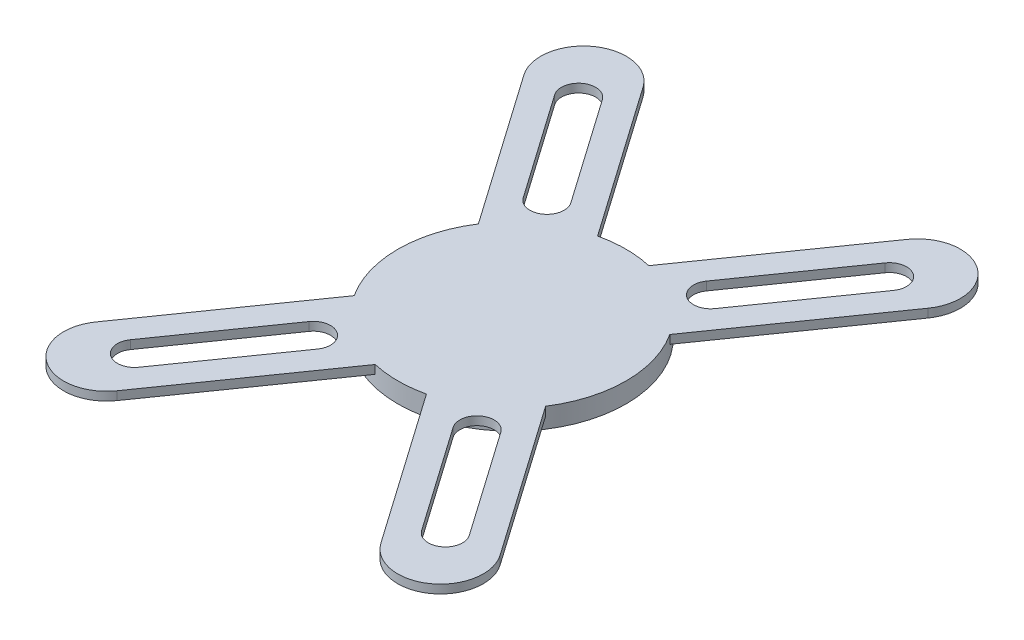
from build123d import *
from build123d.topology import SkipClean

# Parameters (mm, degrees)
SKETCH1_R           = 40
BOSS_EXTRUDE1_DEPTH = 4
BOSS_EXTRUDE2_DEPTH = 3
CUT_EXTRUDE1_DEPTH  = 3


with BuildPart() as part:
    # Sketch1 → Boss-Extrude1 (new body)
    with BuildSketch(Plane(origin=(0, 0, 0), x_dir=(1, 0, 0), z_dir=(0, 1, 0))):
        with Locations(Location((0, 0, 0), (0, 0, 270))):
            Circle(SKETCH1_R)
    extrude(amount=BOSS_EXTRUDE1_DEPTH)

    # Sketch2 → Boss-Extrude2 (add)
    with SkipClean():  # the faces are left unmerged after this step: merging them gives an invalid solid
        with BuildSketch(Plane(origin=(0, 4, 0), x_dir=(1, 0, 0), z_dir=(0, 1, 0))):
            with BuildLine():
                Line((70.838532525, 75.016207091), (33.556064162, 21.771324213))
                ThreePointArc((33.556064162, 21.771324213), (40, 0), (33.556064162, -21.771324213))
                Line((33.556064162, -21.771324213), (70.838532525, -75.016207091))
                ThreePointArc((70.838532525, -75.016207091), (67.154898406, -95.907134301), (46.263971196, -92.223500182))
                Line((46.263971196, -92.223500182), (8.981502833, -38.978617303))
                ThreePointArc((8.981502833, -38.978617303), (0, -40), (-8.981502833, -38.978617303))
                Line((-8.981502833, -38.978617303), (-46.263971196, -92.223500182))
                ThreePointArc((-46.263971196, -92.223500182), (-67.154898406, -95.907134301), (-70.838532525, -75.016207091))
                Line((-70.838532525, -75.016207091), (-33.556064162, -21.771324213))
                ThreePointArc((-33.556064162, -21.771324213), (-40, 0), (-33.556064162, 21.771324213))
                Line((-33.556064162, 21.771324213), (-70.838532525, 75.016207091))
                ThreePointArc((-70.838532525, 75.016207091), (-67.154898406, 95.907134301), (-46.263971196, 92.223500182))
                Line((-46.263971196, 92.223500182), (-8.981502833, 38.978617303))
                ThreePointArc((-8.981502833, 38.978617303), (0, 40), (8.981502833, 38.978617303))
                Line((8.981502833, 38.978617303), (46.263971196, 92.223500182))
                ThreePointArc((46.263971196, 92.223500182), (67.154898406, 95.907134301), (70.838532525, 75.016207091))
            make_face()
        extrude(amount=BOSS_EXTRUDE2_DEPTH)

    # Sketch3 → Cut-Extrude1 (cut)
    with SkipClean():  # the faces are left unmerged after this step: merging them gives an invalid solid
        with BuildSketch(Plane.XZ.offset(-4)):
            with BuildLine():
                Line((33.593734083, -37.516143596), (59.404673719, -74.377985589))
                ThreePointArc((59.404673719, -74.377985589), (57.931220071, -82.734356473), (49.574849188, -81.260902826))
                Line((49.574849188, -81.260902826), (23.763909552, -44.399060833))
                ThreePointArc((23.763909552, -44.399060833), (25.237363199, -36.042689949), (33.593734083, -37.516143596))
            make_face()
            with BuildLine():
                Line((-33.593734083, -37.516143596), (-59.404673719, -74.377985589))
                ThreePointArc((-59.404673719, -74.377985589), (-57.931220071, -82.734356473), (-49.574849188, -81.260902826))
                Line((-49.574849188, -81.260902826), (-23.763909552, -44.399060833))
                ThreePointArc((-23.763909552, -44.399060833), (-25.237363199, -36.042689949), (-33.593734083, -37.516143596))
            make_face()
            with BuildLine():
                Line((23.763909552, 44.399060833), (49.574849188, 81.260902826))
                ThreePointArc((49.574849188, 81.260902826), (57.931220071, 82.734356473), (59.404673719, 74.377985589))
                Line((59.404673719, 74.377985589), (33.593734083, 37.516143596))
                ThreePointArc((33.593734083, 37.516143596), (25.237363199, 36.042689949), (23.763909552, 44.399060833))
            make_face()
            with BuildLine():
                Line((-23.763909552, 44.399060833), (-49.574849188, 81.260902826))
                ThreePointArc((-49.574849188, 81.260902826), (-57.931220071, 82.734356473), (-59.404673719, 74.377985589))
                Line((-59.404673719, 74.377985589), (-33.593734083, 37.516143596))
                ThreePointArc((-33.593734083, 37.516143596), (-25.237363199, 36.042689949), (-23.763909552, 44.399060833))
            make_face()
        extrude(amount=-CUT_EXTRUDE1_DEPTH, mode=Mode.SUBTRACT)


solid = part.part
